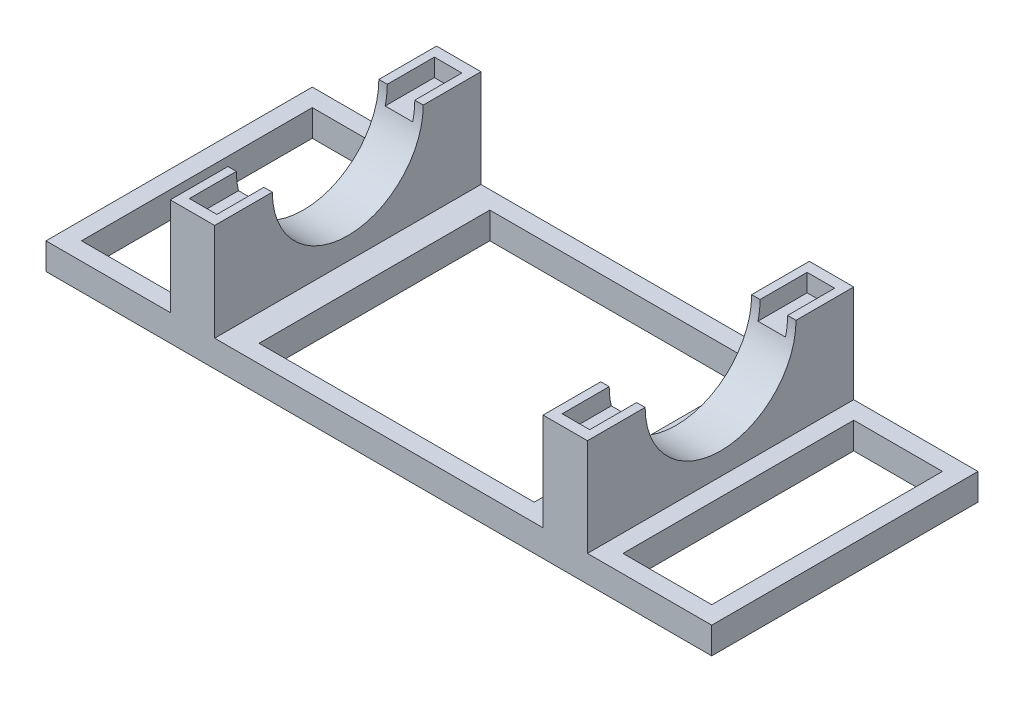
from build123d import *

# Parameters (mm, degrees)
SKETCH_1_W          = 150
SKETCH_1_H          = 60
EXTRUDE_1_DEPTH     = 6
SKETCH_2_W          = 10
SKETCH_2_H          = 60
EXTRUDE_2_DEPTH     = 22
SKETCH_3_W          = 6.2
SKETCH_3_H          = 55.2
CUT_EXTRUDE_1_DEPTH = 4
SKETCH_4_R          = 17
CUT_EXTRUDE_2_DEPTH = 129.716743278
SKETCH_5_W          = 20
SKETCH_5_H          = 52
SKETCH_5_W_2        = 62
CUT_EXTRUDE_3_DEPTH = 84.719770664


with BuildPart() as part:
    # 草图1 → 凸台-拉伸1 (new body)
    with BuildSketch(Plane(origin=(0, 0, 0), x_dir=(1, 0, 0), z_dir=(0, 1, 0))):
        Rectangle(SKETCH_1_W, SKETCH_1_H)
    extrude(amount=EXTRUDE_1_DEPTH)

    # 草图2 → 凸台-拉伸2 (add)
    with BuildSketch(Plane(origin=(0, 6, 0), x_dir=(1, 0, 0), z_dir=(0, 1, 0))):
        with Locations((-42, 0)):
            Rectangle(SKETCH_2_W, SKETCH_2_H)
        with Locations((42, 0)):
            Rectangle(SKETCH_2_W, SKETCH_2_H)
    extrude(amount=EXTRUDE_2_DEPTH)

    # 草图3 → 切除-拉伸1 (cut)
    with BuildSketch(Plane(origin=(0, 28, 0), x_dir=(1, 0, 0), z_dir=(0, 1, 0))):
        with Locations((-42, 0)):
            Rectangle(SKETCH_3_W, SKETCH_3_H)
        with Locations((42, 0)):
            Rectangle(SKETCH_3_W, SKETCH_3_H)
    extrude(amount=-CUT_EXTRUDE_1_DEPTH, mode=Mode.SUBTRACT)

    # 草图4 → 切除-拉伸2 (cut, through all)
    with BuildSketch(Plane.ZY.offset(47)):
        with Locations((0, 28)):
            Circle(SKETCH_4_R)
    extrude(amount=-CUT_EXTRUDE_2_DEPTH, mode=Mode.SUBTRACT)

    # 草图5 → 切除-拉伸3 (cut, through all)
    with BuildSketch(Plane(origin=(0, 6, 0), x_dir=(1, 0, 0), z_dir=(0, 1, 0))):
        with Locations((-61, 0)):
            Rectangle(SKETCH_5_W, SKETCH_5_H)
        with Locations((61, 0)):
            Rectangle(SKETCH_5_W, SKETCH_5_H)
        Rectangle(SKETCH_5_W_2, SKETCH_5_H)
    extrude(amount=-CUT_EXTRUDE_3_DEPTH, mode=Mode.SUBTRACT)


solid = part.part
